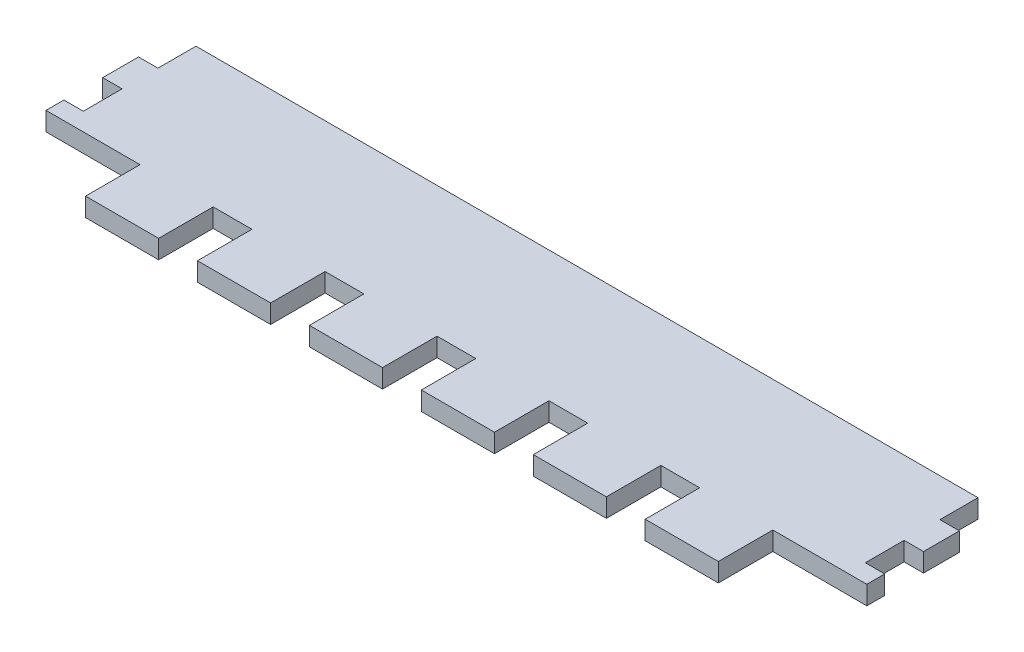
from build123d import *

# Parameters (mm, degrees)
SKETCH1_W           = 279.4
SKETCH1_H           = 57.15
BOSS_EXTRUDE1_DEPTH = 6.35
SKETCH3_W           = 24.892
SKETCH3_H           = 18.542
BOSS_EXTRUDE2_DEPTH = 6.35
SKETCH4_W           = 13.208
SKETCH4_H           = 13.208
CUT_EXTRUDE2_DEPTH  = 148.568371235
SKETCH5_W           = 311.517575851
SKETCH5_H           = 12.7
CUT_EXTRUDE3_DEPTH  = 148.568371235


with BuildPart() as part:
    # Sketch1 → Boss-Extrude1 (new body)
    with BuildSketch(Plane(origin=(0, 0, 0), x_dir=(1, 0, 0), z_dir=(0, 1, 0))):
        Rectangle(SKETCH1_W, SKETCH1_H)
    extrude(amount=BOSS_EXTRUDE1_DEPTH)

    # Sketch3 → Boss-Extrude2 (add)
    with BuildSketch(Plane(origin=(0, 0, 0), x_dir=(1, 0, 0), z_dir=(0, 1, 0))):
        with Locations((-95.25, -37.846)):
            Rectangle(SKETCH3_W, SKETCH3_H)
        with Locations((-57.15, -37.846)):
            Rectangle(SKETCH3_W, SKETCH3_H)
        with Locations((-19.05, -37.846)):
            Rectangle(SKETCH3_W, SKETCH3_H)
        with Locations((19.05, -37.846)):
            Rectangle(SKETCH3_W, SKETCH3_H)
        with Locations((57.15, -37.846)):
            Rectangle(SKETCH3_W, SKETCH3_H)
        with Locations((95.25, -37.846)):
            Rectangle(SKETCH3_W, SKETCH3_H)
    extrude(amount=BOSS_EXTRUDE2_DEPTH)

    # Sketch4 → Cut-Extrude2 (cut, through all)
    with BuildSketch(Plane(origin=(0, 0, 0), x_dir=(1, 0, 0), z_dir=(0, 1, 0))):
        with Locations((-139.7, 9.525)):
            Rectangle(SKETCH4_W, SKETCH4_H)
        with Locations((-139.7, -15.875)):
            Rectangle(SKETCH4_W, SKETCH4_H)
        with Locations((139.7, -15.875)):
            Rectangle(SKETCH4_W, SKETCH4_H)
        with Locations((139.7, 9.525)):
            Rectangle(SKETCH4_W, SKETCH4_H)
    extrude(amount=CUT_EXTRUDE2_DEPTH, mode=Mode.SUBTRACT)

    # Sketch5 → Cut-Extrude3 (cut, through all)
    with BuildSketch(Plane(origin=(0, 6.35, 0), x_dir=(1, 0, 0), z_dir=(0, 1, 0))):
        with Locations((16.058787925, 22.225)):
            Rectangle(SKETCH5_W, SKETCH5_H)
    extrude(amount=-CUT_EXTRUDE3_DEPTH, mode=Mode.SUBTRACT)


solid = part.part
